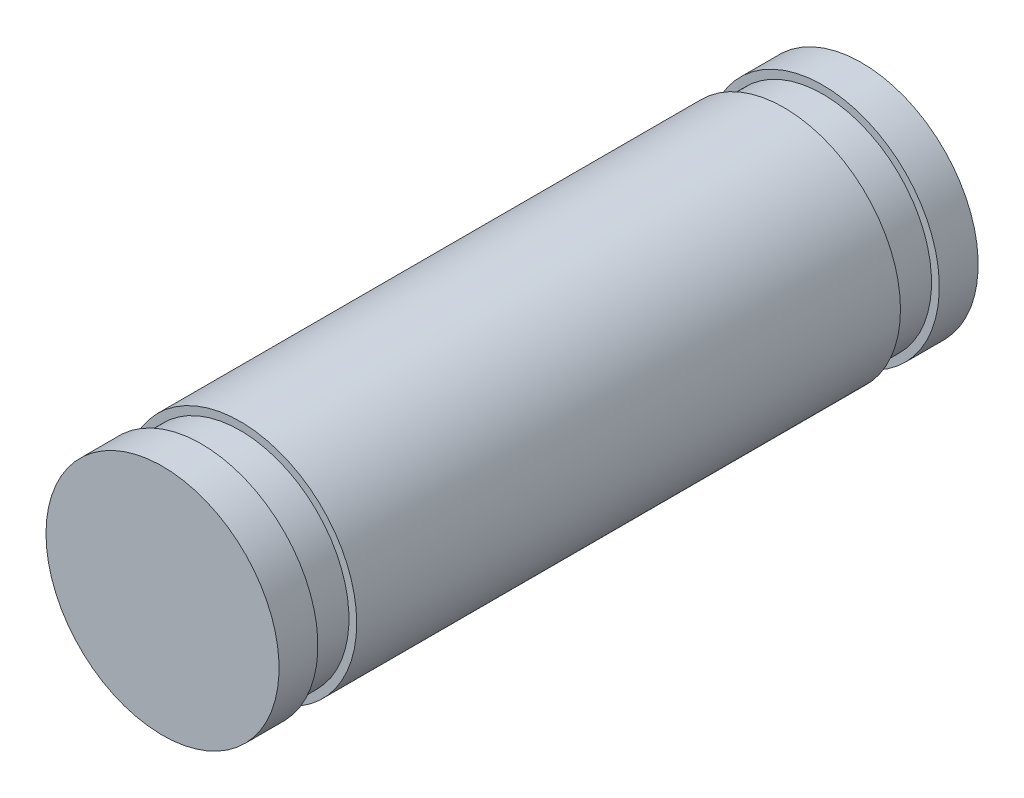
from build123d import *

# Parameters (mm, degrees)
SKETCH1_R           = 1.5
BOSS_EXTRUDE1_DEPTH = 7
SKETCH2_R           = 1.4
BOSS_EXTRUDE2_DEPTH = 0.5
BOSS_EXTRUDE3_START = 0.5
SKETCH3_R           = 1.5
BOSS_EXTRUDE3_DEPTH = 0.5


with BuildPart() as part:
    # Sketch1 → Boss-Extrude1 (new body)
    with BuildSketch(Plane.XY):
        Circle(SKETCH1_R)
    extrude(amount=BOSS_EXTRUDE1_DEPTH)

    # Sketch2 → Boss-Extrude2 (add)
    with BuildSketch(Plane(origin=(0, 0, 0), x_dir=(-1, 0, 0), z_dir=(0, 0, -1))):
        Circle(SKETCH2_R)
    boss_extrude2 = extrude(amount=BOSS_EXTRUDE2_DEPTH)

    # Sketch3 → Boss-Extrude3 (add)
    with BuildSketch(Plane(origin=(0, 0, -0.5), x_dir=(-1, 0, 0), z_dir=(0, 0, -1)).offset(BOSS_EXTRUDE3_START)):
        with Locations(Location((0, 0, 0), (0, 0, 180))):
            Circle(SKETCH3_R)
    boss_extrude3 = extrude(amount=-BOSS_EXTRUDE3_DEPTH)

    # Mirror1: Boss-Extrude2, Boss-Extrude3 across plane
    add(boss_extrude2.mirror(Plane.XY.offset(3.5)))
    add(boss_extrude3.mirror(Plane.XY.offset(3.5)))


solid = part.part
